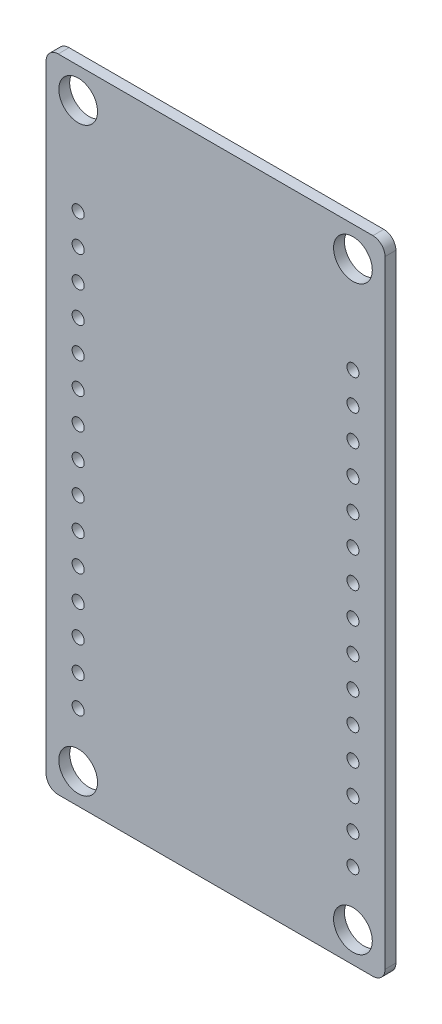
from build123d import *

# Parameters (mm, degrees)
ESBO_O1_W                = 28
ESBO_O1_H                = 53
RESSALTO_EXTRUS_O1_DEPTH = 0.45
CORTE_EXTRUS_O1_REACH    = 31.984
ESBO_O4_R                = 1.6
CORTE_EXTRUS_O2_REACH    = 31.984
ESBO_O5_R                = 0.5
PADR_O_LINEAR1_COUNT     = 15
PADR_O_LINEAR1_PITCH     = 2.54
FILETE1_R                = 1


with BuildPart() as part:
    # Esboço1 → Ressalto-extrusão1 (new, symmetric)
    with BuildSketch(Plane.XY):
        Rectangle(ESBO_O1_W, ESBO_O1_H)
    extrude(amount=RESSALTO_EXTRUS_O1_DEPTH, both=True)

    # Esboço4 → Corte-extrusão1 (cut, up to next)
    with BuildSketch(Plane.XY.offset(0.45), mode=Mode.PRIVATE) as corte_extrus_o1_sk1:
        with Locations((-11.35, -24)):
            Circle(ESBO_O4_R)
    corte_extrus_o1_tool1 = extrude(corte_extrus_o1_sk1.sketch, amount=-CORTE_EXTRUS_O1_REACH, mode=Mode.PRIVATE) & part.part
    # Esboço4 → Corte-extrusão1 (cut, up to next)
    with BuildSketch(Plane.XY.offset(0.45), mode=Mode.PRIVATE) as corte_extrus_o1_sk2:
        with Locations((11.35, -24)):
            Circle(ESBO_O4_R)
    corte_extrus_o1_tool2 = extrude(corte_extrus_o1_sk2.sketch, amount=-CORTE_EXTRUS_O1_REACH, mode=Mode.PRIVATE) & part.part
    # Esboço4 → Corte-extrusão1 (cut, up to next)
    with BuildSketch(Plane.XY.offset(0.45), mode=Mode.PRIVATE) as corte_extrus_o1_sk3:
        with Locations((11.35, 24)):
            Circle(ESBO_O4_R)
    corte_extrus_o1_tool3 = extrude(corte_extrus_o1_sk3.sketch, amount=-CORTE_EXTRUS_O1_REACH, mode=Mode.PRIVATE) & part.part
    # Esboço4 → Corte-extrusão1 (cut, up to next)
    with BuildSketch(Plane.XY.offset(0.45), mode=Mode.PRIVATE) as corte_extrus_o1_sk4:
        with Locations((-11.35, 24)):
            Circle(ESBO_O4_R)
    corte_extrus_o1_tool4 = extrude(corte_extrus_o1_sk4.sketch, amount=-CORTE_EXTRUS_O1_REACH, mode=Mode.PRIVATE) & part.part
    add(corte_extrus_o1_tool1.solids().sort_by_distance((-11.35, -24, 0.45))[0], mode=Mode.SUBTRACT)
    add(corte_extrus_o1_tool2.solids().sort_by_distance((11.35, -24, 0.45))[0], mode=Mode.SUBTRACT)
    add(corte_extrus_o1_tool3.solids().sort_by_distance((11.35, 24, 0.45))[0], mode=Mode.SUBTRACT)
    add(corte_extrus_o1_tool4.solids().sort_by_distance((-11.35, 24, 0.45))[0], mode=Mode.SUBTRACT)

    # Esboço5 → Corte-extrusão2 (cut, up to next)
    with BuildSketch(Plane.XY.offset(0.45), mode=Mode.PRIVATE) as corte_extrus_o2_sk1:
        with Locations((-11.35, -19.5)):
            Circle(ESBO_O5_R)
    corte_extrus_o2_tool1 = extrude(corte_extrus_o2_sk1.sketch, amount=-CORTE_EXTRUS_O2_REACH, mode=Mode.PRIVATE) & part.part
    # Esboço5 → Corte-extrusão2 (cut, up to next)
    with BuildSketch(Plane.XY.offset(0.45), mode=Mode.PRIVATE) as corte_extrus_o2_sk2:
        with Locations((11.35, -19.5)):
            Circle(ESBO_O5_R)
    corte_extrus_o2_tool2 = extrude(corte_extrus_o2_sk2.sketch, amount=-CORTE_EXTRUS_O2_REACH, mode=Mode.PRIVATE) & part.part
    corte_extrus_o2_1 = corte_extrus_o2_tool1.solids().sort_by_distance((-11.35, -19.5, 0.45))[0]
    add(corte_extrus_o2_1, mode=Mode.SUBTRACT)
    corte_extrus_o2_2 = corte_extrus_o2_tool2.solids().sort_by_distance((11.35, -19.5, 0.45))[0]
    add(corte_extrus_o2_2, mode=Mode.SUBTRACT)
    corte_extrus_o2 = corte_extrus_o2_1 + corte_extrus_o2_2  # Corte-extrusão2 as one shape, for the pattern or mirror that repeats it

    # Padrão linear1: Corte-extrusão2 ×15
    with Locations(*[(0, i * PADR_O_LINEAR1_PITCH, 0) for i in range(1, PADR_O_LINEAR1_COUNT)]):
        add(corte_extrus_o2, mode=Mode.SUBTRACT)

    # Filete1
    filete1_edges = [part.edges().sort_by_distance(p)[0] for p in [
        (-14, 26.5, 0),
        (14, 26.5, 0),
        (14, -26.5, 0),
        (-14, -26.5, 0),
    ]]
    fillet(filete1_edges, radius=FILETE1_R)


solid = part.part
